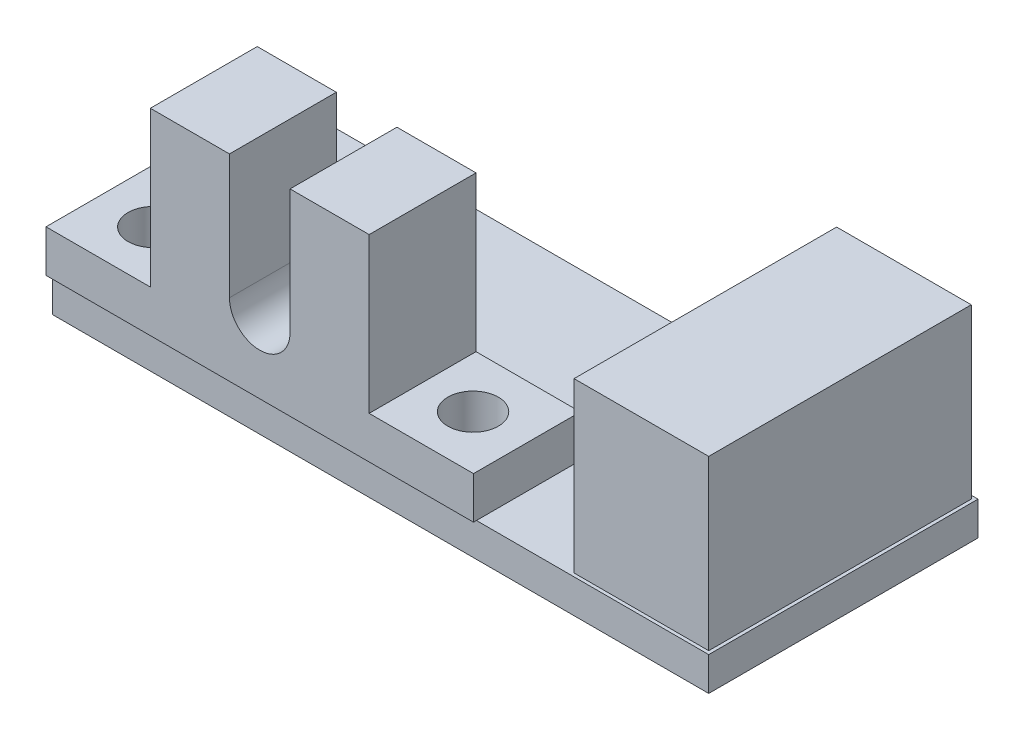
from build123d import *

# Parameters (mm, degrees)
SKETCH1_W           = 39
SKETCH1_H           = 16
SKETCH1_R           = 1.5
BOSS_EXTRUDE1_DEPTH = 2
SKETCH3_W           = 25.4
SKETCH3_H           = 6.35
SKETCH3_R           = 1.5
BOSS_EXTRUDE2_DEPTH = 2.5
BOSS_EXTRUDE3_DEPTH = 6.35
SKETCH5_W           = 8
SKETCH5_H           = 15.6
BOSS_EXTRUDE4_DEPTH = 10


with BuildPart() as part:
    # Sketch1 → Boss-Extrude1 (new body)
    with BuildSketch(Plane(origin=(0, 0, 0), x_dir=(1, 0, 0), z_dir=(0, 1, 0))):
        Rectangle(SKETCH1_W, SKETCH1_H)
        with Locations(Location((-16.5, -5, 0), (0, 0, 270))):
            Circle(SKETCH1_R, mode=Mode.SUBTRACT)
        with Locations(Location((2.5, -5, 0), (0, 0, 270))):
            Circle(SKETCH1_R, mode=Mode.SUBTRACT)
    extrude(amount=BOSS_EXTRUDE1_DEPTH)

    # Sketch3 → Boss-Extrude2 (add)
    with BuildSketch(Plane(origin=(0, 2, 0), x_dir=(1, 0, 0), z_dir=(0, 1, 0))):
        with Locations((-7, -5)):
            Rectangle(SKETCH3_W, SKETCH3_H)
        with Locations(Location((-16.5, -5, 0), (0, 0, 270))):
            Circle(SKETCH3_R, mode=Mode.SUBTRACT)
        with Locations(Location((2.5, -5, 0), (0, 0, 270))):
            Circle(SKETCH3_R, mode=Mode.SUBTRACT)
    extrude(amount=BOSS_EXTRUDE2_DEPTH)

    # Sketch4 → Boss-Extrude3 (add)
    with BuildSketch(Plane.XY.offset(8.175)):
        with BuildLine():
            Line((-8.8, 13.7), (-13.5, 13.7))
            Line((-13.5, 13.7), (-13.5, 4.5))
            Line((-13.5, 4.5), (-6.999999998, 4.5))
            ThreePointArc((-6.999999998, 4.5), (-8.272792205, 5.027207793), (-8.8, 6.3))
            Line((-8.8, 6.3), (-8.8, 13.7))
        make_face()
        with BuildLine():
            ThreePointArc((-5.2, 6.3), (-5.727207793, 5.027207795), (-6.999999998, 4.5))
            Line((-6.999999998, 4.5), (-0.5, 4.5))
            Line((-0.5, 4.5), (-0.5, 13.7))
            Line((-0.5, 13.7), (-5.2, 13.7))
            Line((-5.2, 13.7), (-5.2, 6.3))
        make_face()
    extrude(amount=-BOSS_EXTRUDE3_DEPTH)

    # Sketch5 → Boss-Extrude4 (add)
    with BuildSketch(Plane(origin=(0, 2, 0), x_dir=(1, 0, 0), z_dir=(0, 1, 0))):
        with Locations((15.3, 0)):
            Rectangle(SKETCH5_W, SKETCH5_H)
    extrude(amount=BOSS_EXTRUDE4_DEPTH)


solid = part.part
